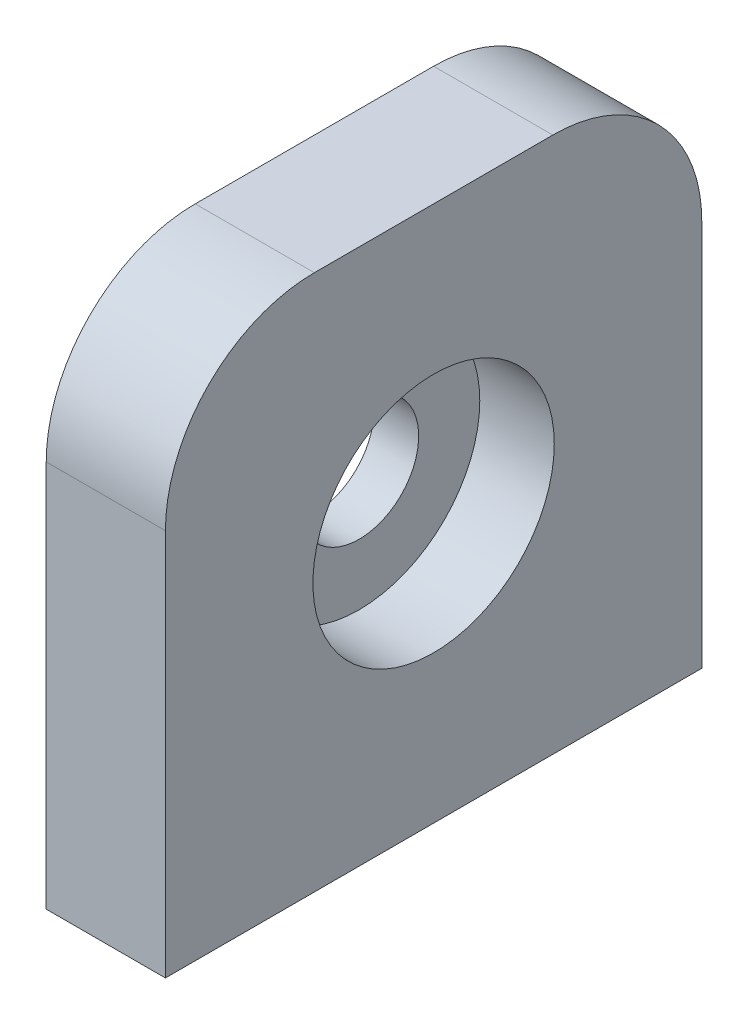
from build123d import *

# Parameters (mm, degrees)
ESQUISSE1_W             = 8
ESQUISSE1_H             = 36
BOSS_EXTRU_3_DEPTH      = 36
ESQUISSE9_R             = 8.1
ENL_V_MAT_EXTRU_1_DEPTH = 10
BOSS_EXTRU_4_START      = -3
ESQUISSE10_R            = 8.1
ESQUISSE10_R_2          = 4
BOSS_EXTRU_4_DEPTH      = 3
ESQUISSE13_R            = 2
ENL_V_MAT_EXTRU_2_DEPTH = 15
CONG_1_R                = 10


with BuildPart() as part:
    # Esquisse1 → Boss.-Extru.3 (new body)
    with BuildSketch(Plane(origin=(0, 0, 0), x_dir=(1, 0, 0), z_dir=(0, 1, 0))):
        with Locations((4, 18)):
            Rectangle(ESQUISSE1_W, ESQUISSE1_H)
    extrude(amount=BOSS_EXTRU_3_DEPTH)

    # Esquisse9 → Enlèv. mat.-Extru.1 (cut)
    with BuildSketch(Plane(origin=(8, 0, 0), x_dir=(0, 0, -1), z_dir=(1, 0, 0))):
        with Locations((18, 18)):
            Circle(ESQUISSE9_R)
    extrude(amount=-ENL_V_MAT_EXTRU_1_DEPTH, mode=Mode.SUBTRACT)

    # Esquisse10 → Boss.-Extru.4 (add)
    with BuildSketch(Plane.ZY.offset(BOSS_EXTRU_4_START)):
        with Locations((-18, 18)):
            Circle(ESQUISSE10_R)
        with Locations((-18, 18)):
            Circle(ESQUISSE10_R_2, mode=Mode.SUBTRACT)
    extrude(amount=BOSS_EXTRU_4_DEPTH)

    # Esquisse13 → Enlèv. mat.-Extru.2 (cut)
    with BuildSketch(Plane.XZ):
        with Locations((4, -4)):
            Circle(ESQUISSE13_R)
        with Locations((4, -32)):
            Circle(ESQUISSE13_R)
    extrude(amount=-ENL_V_MAT_EXTRU_2_DEPTH, mode=Mode.SUBTRACT)

    # Congé1
    cong_1_edges = [part.edges().sort_by_distance(p)[0] for p in [
        (4, 36, -36),
        (4, 36, 0),
    ]]
    fillet(cong_1_edges, radius=CONG_1_R)


solid = part.part
